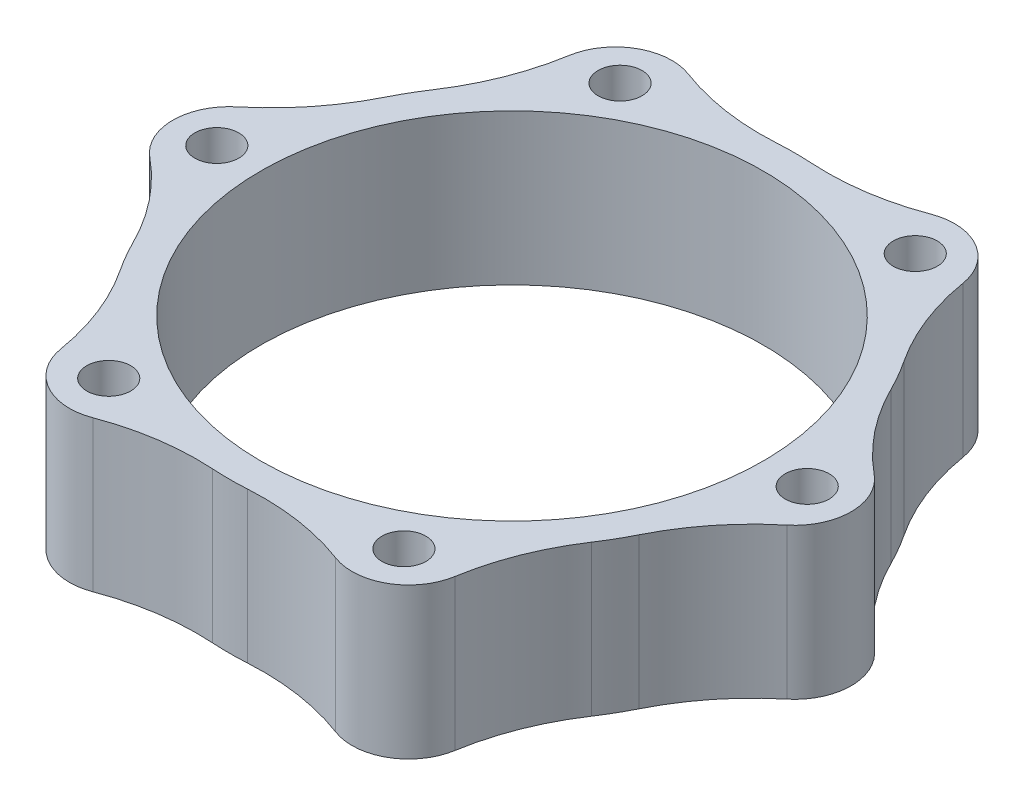
from build123d import *

# Parameters (mm, degrees)
SKETCH1_R                = 28.575
SKETCH1_R_2              = 25.4
BOSS_EXTRUDE1_DEPTH      = 15.24
BOSS_EXTRUDE2_START      = -15.24
BOSS_EXTRUDE2_DEPTH      = 15.24
FILLET1_R                = 25.4
CIRPATTERN1_COUNT        = 6
FILLET1_OF_CIRPATTERN1_R = 25.4
SKETCH3_R                = 2.2225
CUT_EXTRUDE1_DEPTH       = 49.331929565
CIRPATTERN2_COUNT        = 6


with BuildPart() as part:
    # Sketch1 → Boss-Extrude1 (new body)
    with BuildSketch(Plane(origin=(0, 0, 0), x_dir=(1, 0, 0), z_dir=(0, 1, 0))):
        with Locations(Location((0, 0, 0), (0, 0, 270))):
            Circle(SKETCH1_R)
        with Locations(Location((0, 0, 0), (0, 0, 270))):
            Circle(SKETCH1_R_2, mode=Mode.SUBTRACT)
    extrude(amount=BOSS_EXTRUDE1_DEPTH)

    # Sketch2 → Boss-Extrude2 (add)
    with BuildSketch(Plane(origin=(0, 15.24, 0), x_dir=(1, 0, 0), z_dir=(0, 1, 0)).offset(BOSS_EXTRUDE2_START)):
        with BuildLine():
            ThreePointArc((-28.0035, 5.686353203), (-34.29, 0), (-28.0035, -5.686353203))
            ThreePointArc((-28.0035, -5.686353203), (-28.575, 0), (-28.0035, 5.686353203))
        make_face()
    boss_extrude2 = extrude(amount=BOSS_EXTRUDE2_DEPTH)

    # Fillet1
    fillet1_edges = [part.edges().sort_by_distance(p)[0] for p in [
        (-28.0035, 7.62, -5.686353203),
        (-28.0035, 7.62, 5.686353203),
    ]]
    fillet(fillet1_edges, radius=FILLET1_R)

    # CirPattern1: Boss-Extrude2 ×6 about axis
    cirpattern1_axis = Axis((0, 0, 0), (0, 1, 0))
    for i in range(1, CIRPATTERN1_COUNT):
        add(boss_extrude2.rotate(cirpattern1_axis, i * 360 / CIRPATTERN1_COUNT))

    # Fillet1 of CirPattern1
    fillet1_of_cirpattern1_edges = [part.edges().sort_by_distance(p)[0] for p in [
        (-18.926276329, 7.62, 21.408565793),
        (-9.077223671, 7.62, 27.094918996),
        (9.077223671, 7.62, 27.094918996),
        (18.926276329, 7.62, 21.408565793),
        (28.0035, 7.62, 5.686353203),
        (28.0035, 7.62, -5.686353203),
        (18.926276329, 7.62, -21.408565793),
        (9.077223671, 7.62, -27.094918996),
        (-9.077223671, 7.62, -27.094918996),
        (-18.926276329, 7.62, -21.408565793),
    ]]
    fillet(fillet1_of_cirpattern1_edges, radius=FILLET1_OF_CIRPATTERN1_R)

    # Sketch3 → Cut-Extrude1 (cut, symmetric)
    with BuildSketch(Plane(origin=(0, 15.24, 0), x_dir=(1, 0, 0), z_dir=(0, 1, 0))):
        with Locations(Location((-29.845, 0, 0), (0, 0, 270))):
            Circle(SKETCH3_R)
    cut_extrude1 = extrude(amount=CUT_EXTRUDE1_DEPTH, both=True, mode=Mode.SUBTRACT)

    # CirPattern2: Cut-Extrude1 ×6 about axis
    cirpattern2_axis = Axis((0, 0, 0), (0, 1, 0))
    for i in range(1, CIRPATTERN2_COUNT):
        add(cut_extrude1.rotate(cirpattern2_axis, i * 360 / CIRPATTERN2_COUNT), mode=Mode.SUBTRACT)


solid = part.part
